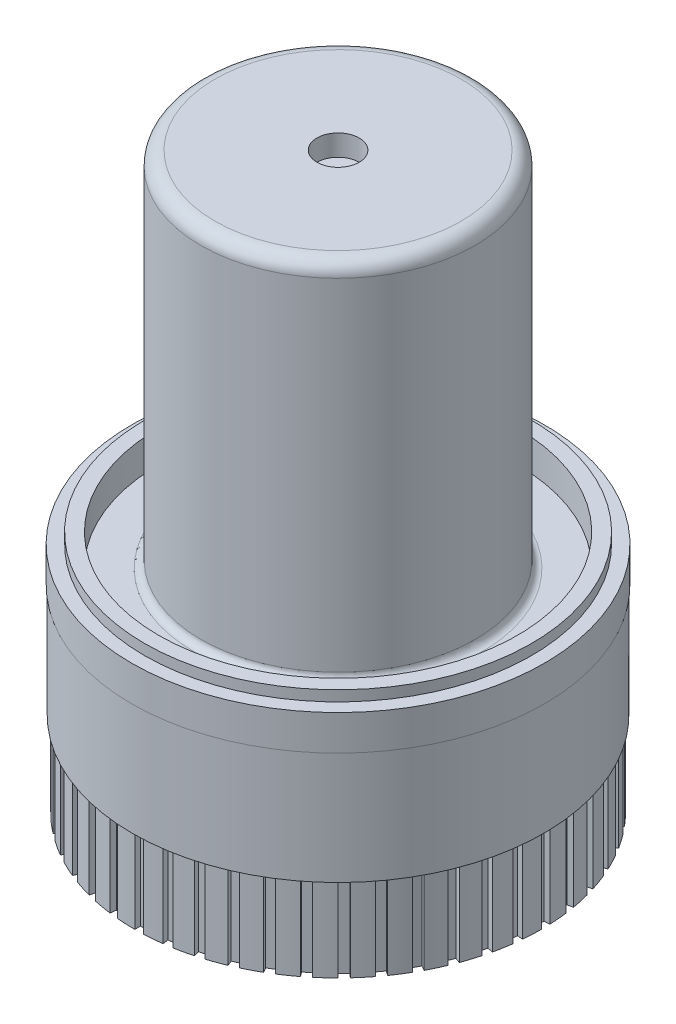
from build123d import *

# Parameters (mm, degrees)
SKETCH1_R           = 29.25
BOSS_EXTRUDE1_DEPTH = 16
SKETCH2_R           = 29.35
BOSS_EXTRUDE2_DEPTH = 5
SKETCH3_R           = 27.5
BOSS_EXTRUDE3_DEPTH = 1.5
SKETCH4_R           = 28.9
BOSS_EXTRUDE4_DEPTH = 12
CUT_EXTRUDE1_START  = -12
CUT_EXTRUDE1_DEPTH  = 12
CIRPATTERN1_COUNT   = 48
SKETCH7_R           = 25.5
CUT_EXTRUDE2_DEPTH  = 4.5
SKETCH8_R           = 19.5
BOSS_EXTRUDE6_DEPTH = 51.5
FILLET1_R           = 2
SKETCH9_R           = 3
CUT_EXTRUDE3_DEPTH  = 3
FILLET2_R           = 1


with BuildPart() as part:
    # Sketch1 → Boss-Extrude1 (new body)
    with BuildSketch(Plane(origin=(0, 0, 0), x_dir=(1, 0, 0), z_dir=(0, 1, 0))):
        with Locations(Location((0, 0, 0), (0, 0, 270))):
            Circle(SKETCH1_R)
    extrude(amount=BOSS_EXTRUDE1_DEPTH)

    # Sketch2 → Boss-Extrude2 (add)
    with BuildSketch(Plane(origin=(0, 16, 0), x_dir=(1, 0, 0), z_dir=(0, 1, 0))):
        with Locations(Location((0, 0, 0), (0, 0, 270))):
            Circle(SKETCH2_R)
    extrude(amount=BOSS_EXTRUDE2_DEPTH)

    # Sketch3 → Boss-Extrude3 (add)
    with BuildSketch(Plane(origin=(0, 21, 0), x_dir=(1, 0, 0), z_dir=(0, 1, 0))):
        with Locations(Location((0, 0, 0), (0, 0, 270))):
            Circle(SKETCH3_R)
    extrude(amount=BOSS_EXTRUDE3_DEPTH)

    # Sketch4 → Boss-Extrude4 (add)
    with BuildSketch(Plane.XZ):
        with Locations(Location((0, 0, 0), (0, 0, 90))):
            Circle(SKETCH4_R)
    extrude(amount=BOSS_EXTRUDE4_DEPTH)

    # Sketch6 → Cut-Extrude1 (cut)
    with BuildSketch(Plane.XZ.offset(12).offset(CUT_EXTRUDE1_START)):
        with BuildLine():
            Line((0, 28.9), (0, 28.09982012))
            Line((0, 28.09982012), (1.199730241, 28.074377061))
            Line((1.199730241, 28.074377061), (1.233886262, 28.873647582))
            ThreePointArc((1.233886262, 28.873647582), (0.617083819, 28.893411144), (0, 28.9))
        make_face()
    cut_extrude1 = extrude(amount=CUT_EXTRUDE1_DEPTH, mode=Mode.SUBTRACT)

    # CirPattern1: Cut-Extrude1 ×48 about axis
    cirpattern1_axis = Axis((0, 0, 0), (0, 1, 0))
    for i in range(1, CIRPATTERN1_COUNT):
        add(cut_extrude1.rotate(cirpattern1_axis, i * 360 / CIRPATTERN1_COUNT), mode=Mode.SUBTRACT)

    # Sketch7 → Cut-Extrude2 (cut)
    with BuildSketch(Plane(origin=(0, 22.5, 0), x_dir=(1, 0, 0), z_dir=(0, 1, 0))):
        with Locations(Location((0, 0, 0), (0, 0, 270))):
            Circle(SKETCH7_R)
    extrude(amount=-CUT_EXTRUDE2_DEPTH, mode=Mode.SUBTRACT)

    # Sketch8 → Boss-Extrude6 (add)
    with BuildSketch(Plane(origin=(0, 18, 0), x_dir=(1, 0, 0), z_dir=(0, 1, 0))):
        with Locations(Location((0, 0, 0), (0, 0, 270))):
            Circle(SKETCH8_R)
    extrude(amount=BOSS_EXTRUDE6_DEPTH)

    # Fillet1
    fillet1_edges = [part.edges().sort_by_distance(p)[0] for p in [
        (0, 69.5, -19.5),
    ]]
    fillet(fillet1_edges, radius=FILLET1_R)

    # Sketch9 → Cut-Extrude3 (cut)
    with BuildSketch(Plane(origin=(0, 69.5, 0), x_dir=(1, 0, 0), z_dir=(0, 1, 0))):
        with Locations(Location((0, 0, 0), (0, 0, 270))):
            Circle(SKETCH9_R)
    extrude(amount=-CUT_EXTRUDE3_DEPTH, mode=Mode.SUBTRACT)

    # Fillet2
    fillet2_edges = [part.edges().sort_by_distance(p)[0] for p in [
        (0, 18, -19.5),
    ]]
    fillet(fillet2_edges, radius=FILLET2_R)


solid = part.part
